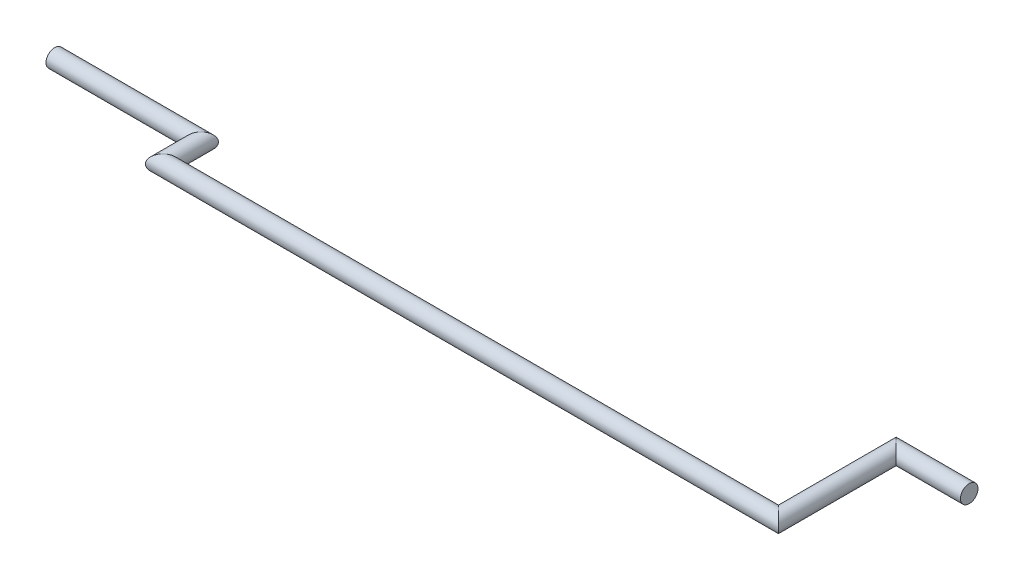
from build123d import *

# Parameters (mm, degrees)
SWEEP1_PROFILE_R = 0.6


with BuildPart() as part:
    # Sweep1: sweep along a path in Sketch1
    with BuildLine(Plane(origin=(0, 0, 0), x_dir=(1, 0, 0), z_dir=(0, 1, 0))) as sweep1_path:
        Line((-10, 2.6), (0, 2.6))
        Line((0, 2.6), (0, 0))
        Line((0, 0), (42.11, 0))
        Line((42.11, 0), (42.11, 8.05))
        Line((42.11, 8.05), (47.11, 8.05))
    # Sweep1 profile (on start of the path) → Sweep1 (sweep)
    with BuildSketch(Plane(origin=(-10, 0, -2.6), x_dir=(0, 0, 1), z_dir=(1, 0, 0))):
        Circle(SWEEP1_PROFILE_R)
    sweep(path=sweep1_path.line, transition=Transition.RIGHT)


solid = part.part
